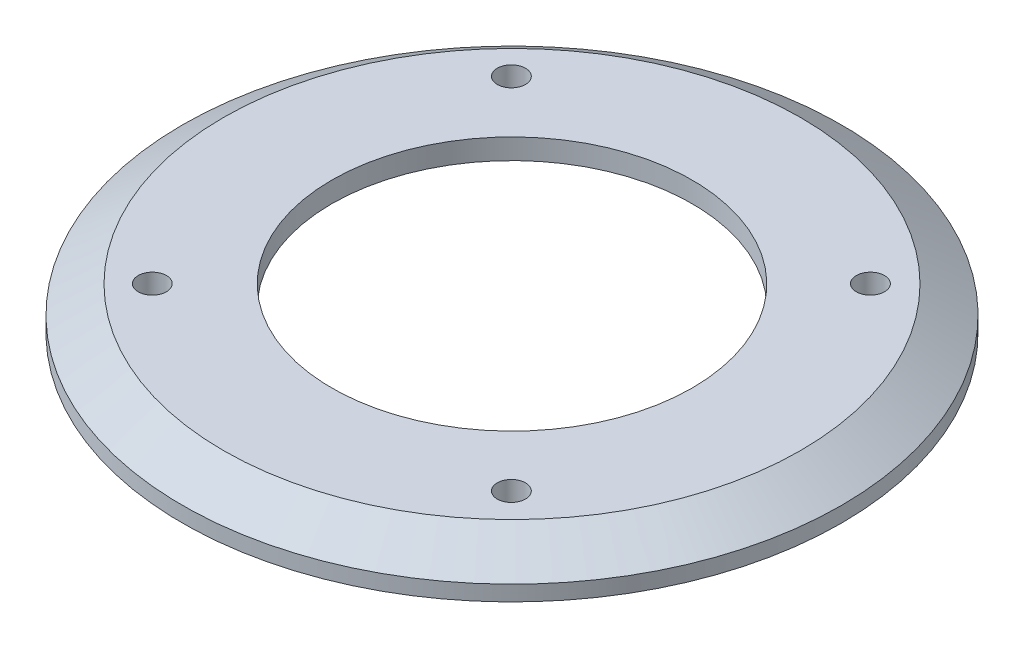
from build123d import *

# Parameters (mm, degrees)
SKETCH_2_R          = 5.5
CUT_EXTRUDE_1_DEPTH = 10


with BuildPart() as part:
    # 草图1 → 旋转1 (revolve)
    with BuildSketch(Plane.XY):
        Polygon((-84.972745292, -8.788732394), (-127.222745292, -8.788732394), (-143.222745292, -19.288732394), (-143.222745292, -25.288732394), (-128.222745292, -25.288732394), (-128.222745292, -16.788732394), (-84.972745292, -16.788732394), align=None)
    revolve(axis=Axis((-14.722745292, 34.411267606, 0), (0, -1, 0)))

    # 草图2 → 切除-拉伸1 (cut)
    with BuildSketch(Plane.XZ.offset(16.788732394)):
        with Locations(Location((-84.972745292, 70, 0), (0, 0, 270))):
            Circle(SKETCH_2_R)
        with Locations(Location((55.027254708, 70, 0), (0, 0, 270))):
            Circle(SKETCH_2_R)
        with Locations(Location((55.027254708, -70, 0), (0, 0, 270))):
            Circle(SKETCH_2_R)
        with Locations(Location((-84.972745292, -70, 0), (0, 0, 270))):
            Circle(SKETCH_2_R)
    extrude(amount=-CUT_EXTRUDE_1_DEPTH, mode=Mode.SUBTRACT)


solid = part.part
